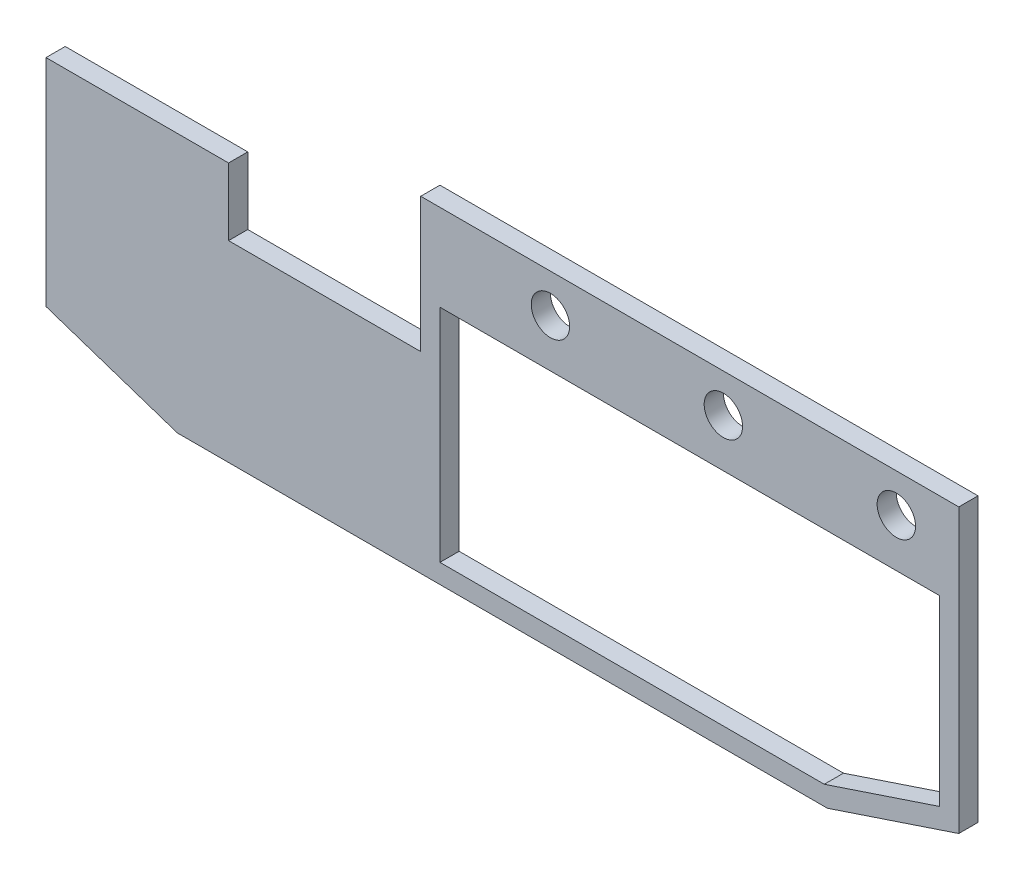
from build123d import *

# Parameters (mm, degrees)
BOSS_EXTRUDE1_DEPTH   = 2
F_4_0MM_DOWEL_HOLE1_D = 4
CUT_EXTRUDE1_REACH    = 98.322
BOSS_EXTRUDE2_DEPTH   = 2


with BuildPart() as part:
    # Sketch2 → Boss-Extrude1 (new body)
    with BuildSketch(Plane.XY):
        Polygon((2, 9), (-54, 9), (-54, -5), (-74, -5), (-74, 2), (-93, 2), (-93, -20.44151844), (-79.32455532, -25), (-11.67544468, -25), (2, -20.44151844), align=None)
    extrude(amount=-BOSS_EXTRUDE1_DEPTH)

    # Ø4.0mm Dowel Hole1 (through all)
    with Locations(Plane.XY):
        with Locations((-40.5, 5), (-22.5, 5), (-4.5, 5)):
            Hole(F_4_0MM_DOWEL_HOLE1_D / 2)

    # Sketch1 → Cut-Extrude1 (cut, up to next)
    with BuildSketch(Plane.XY, mode=Mode.PRIVATE) as cut_extrude1_sk1:
        Polygon((0, 0), (0, -19), (-12, -23), (-79, -23), (-91, -19), (-91, 0), (-76, 0), (-76, -7), (-52, -7), (-52, 0), align=None)
    cut_extrude1_tool1 = extrude(cut_extrude1_sk1.sketch, amount=-CUT_EXTRUDE1_REACH, mode=Mode.PRIVATE) & part.part
    add(cut_extrude1_tool1.solids().sort_by_distance((-43.844166, -11.956047, 0))[0], mode=Mode.SUBTRACT)

    # Sketch5 → Boss-Extrude2 (add)
    with BuildSketch(Plane.XY):
        Polygon((-52, -7), (-52, -23), (-79, -23), (-91, -19), (-91, 0), (-76, 0), (-76, -7), align=None)
    extrude(amount=-BOSS_EXTRUDE2_DEPTH)


solid = part.part
